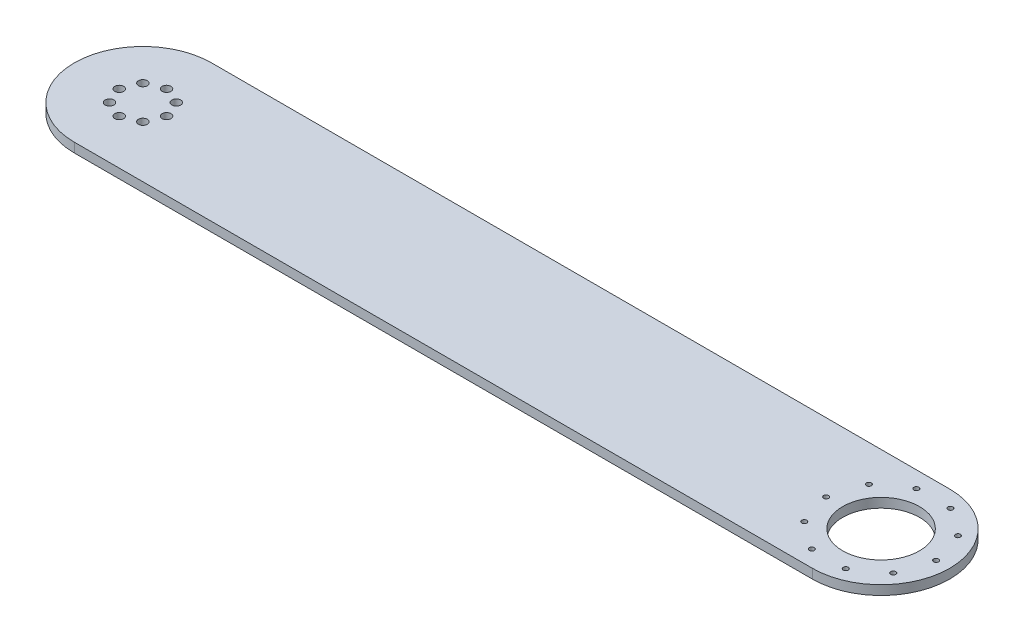
from build123d import *

# Parameters (mm, degrees)
SKETCH1_R           = 3
SKETCH1_R_2         = 1.7
SKETCH1_R_3         = 26
BOSS_EXTRUDE1_DEPTH = 6.35


with BuildPart() as part:
    # Sketch1 → Boss-Extrude1 (new body)
    with BuildSketch(Plane(origin=(0, 0, 0), x_dir=(1, 0, 0), z_dir=(0, 1, 0))):
        with BuildLine():
            Line((0, 46.5), (500, 46.5))
            ThreePointArc((500, 46.5), (546.5, 0), (500, -46.5))
            Line((500, -46.5), (0, -46.5))
            ThreePointArc((0, -46.5), (-46.5, 0), (0, 46.5))
        make_face()
        with Locations(Location((-16, 0, 0), (0, 0, 270))):
            Circle(SKETCH1_R, mode=Mode.SUBTRACT)
        with Locations(Location((-11.313708499, 11.313708499, 0), (0, 0, 270))):
            Circle(SKETCH1_R, mode=Mode.SUBTRACT)
        with Locations(Location((0, 16, 0), (0, 0, 270))):
            Circle(SKETCH1_R, mode=Mode.SUBTRACT)
        with Locations(Location((11.313708499, 11.313708499, 0), (0, 0, 270))):
            Circle(SKETCH1_R, mode=Mode.SUBTRACT)
        with Locations(Location((16, 0, 0), (0, 0, 270))):
            Circle(SKETCH1_R, mode=Mode.SUBTRACT)
        with Locations(Location((11.313708499, -11.313708499, 0), (0, 0, 270))):
            Circle(SKETCH1_R, mode=Mode.SUBTRACT)
        with Locations(Location((537.25, 0, 0), (0, 0, 270))):
            Circle(SKETCH1_R_2, mode=Mode.SUBTRACT)
        with Locations(Location((530.13588304, -21.895000648, 0), (0, 0, 270))):
            Circle(SKETCH1_R_2, mode=Mode.SUBTRACT)
        with Locations(Location((511.51088304, -35.426855232, 0), (0, 0, 270))):
            Circle(SKETCH1_R_2, mode=Mode.SUBTRACT)
        with Locations(Location((488.48911696, -35.426855232, 0), (0, 0, 270))):
            Circle(SKETCH1_R_2, mode=Mode.SUBTRACT)
        with Locations(Location((469.86411696, -21.895000648, 0), (0, 0, 270))):
            Circle(SKETCH1_R_2, mode=Mode.SUBTRACT)
        with Locations(Location((462.75, 0, 0), (0, 0, 270))):
            Circle(SKETCH1_R_2, mode=Mode.SUBTRACT)
        with Locations(Location((469.86411696, 21.895000648, 0), (0, 0, 270))):
            Circle(SKETCH1_R_2, mode=Mode.SUBTRACT)
        with Locations(Location((488.48911696, 35.426855232, 0), (0, 0, 270))):
            Circle(SKETCH1_R_2, mode=Mode.SUBTRACT)
        with Locations(Location((511.51088304, 35.426855232, 0), (0, 0, 270))):
            Circle(SKETCH1_R_2, mode=Mode.SUBTRACT)
        with Locations(Location((530.13588304, 21.895000648, 0), (0, 0, 270))):
            Circle(SKETCH1_R_2, mode=Mode.SUBTRACT)
        with Locations(Location((500, 0, 0), (0, 0, 270))):
            Circle(SKETCH1_R_3, mode=Mode.SUBTRACT)
        with Locations(Location((0, -16, 0), (0, 0, 270))):
            Circle(SKETCH1_R, mode=Mode.SUBTRACT)
        with Locations(Location((-11.313708499, -11.313708499, 0), (0, 0, 270))):
            Circle(SKETCH1_R, mode=Mode.SUBTRACT)
    extrude(amount=BOSS_EXTRUDE1_DEPTH)


solid = part.part
